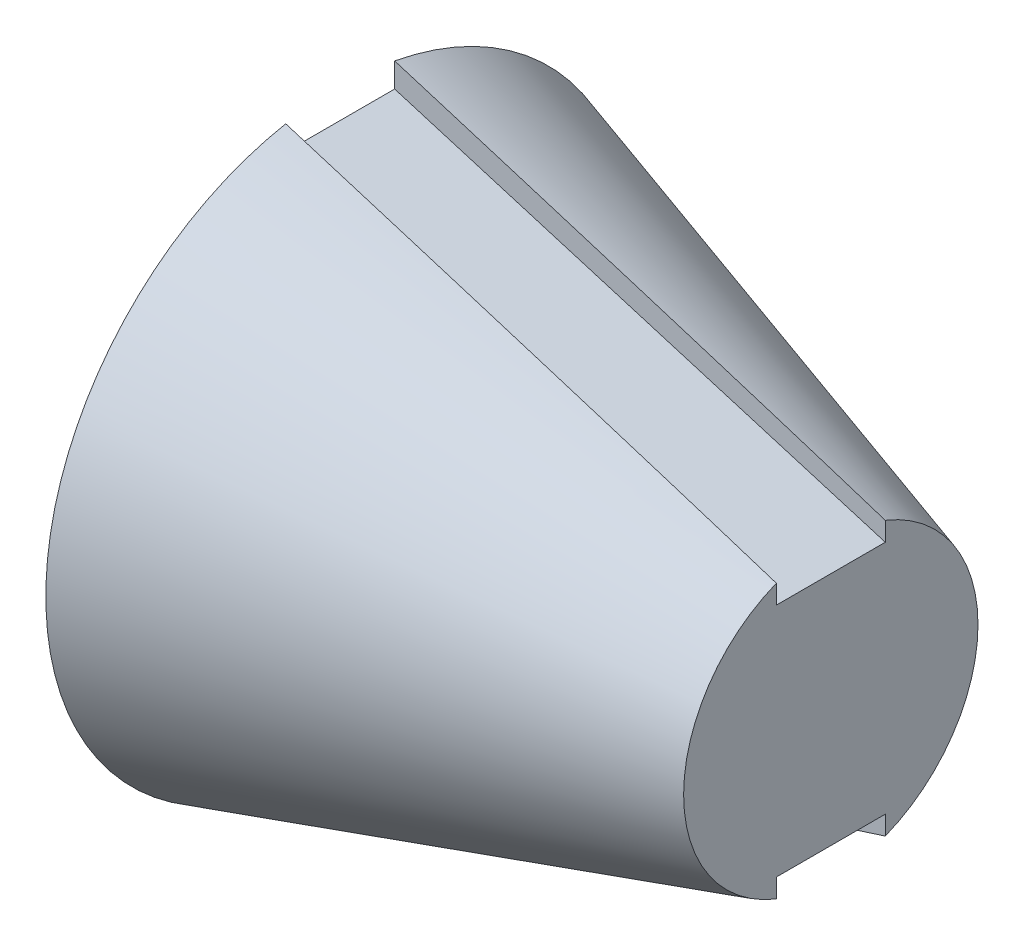
from build123d import *

# Parameters (mm, degrees)
SKETCH2_R               = 15
CUT_EXTRUDE1_DEPTH      = 10
CUT_EXTRUDE2_DEPTH      = 5.55
CUT_EXTRUDE2_DEPTH_BACK = 5.55


with BuildPart() as part:
    # Sketch1 → Revolve1 (revolve)
    with BuildSketch(Plane.XY):
        Polygon((0, 0), (-50, 0), (-50, 30), (0, 15), align=None)
    revolve(axis=Axis((0, 0, 0), (-1, 0, 0)))

    # Sketch2 → Cut-Extrude1 (cut)
    with BuildSketch(Plane.ZY.offset(50)):
        Circle(SKETCH2_R)
    extrude(amount=-CUT_EXTRUDE1_DEPTH, mode=Mode.SUBTRACT)

    # Sketch4 → Cut-Extrude2 (cut, two sides: drawn at the far end of the back side and taken through both)
    with BuildSketch(Plane.XY.offset(-CUT_EXTRUDE2_DEPTH_BACK)):
        Polygon((0, 15), (0, 12), (-50, 27), (-50, 30), align=None)
        Polygon((0, -15), (0, -12), (-50, -27), (-50, -30), align=None)
    extrude(amount=CUT_EXTRUDE2_DEPTH + CUT_EXTRUDE2_DEPTH_BACK, mode=Mode.SUBTRACT)


solid = part.part
